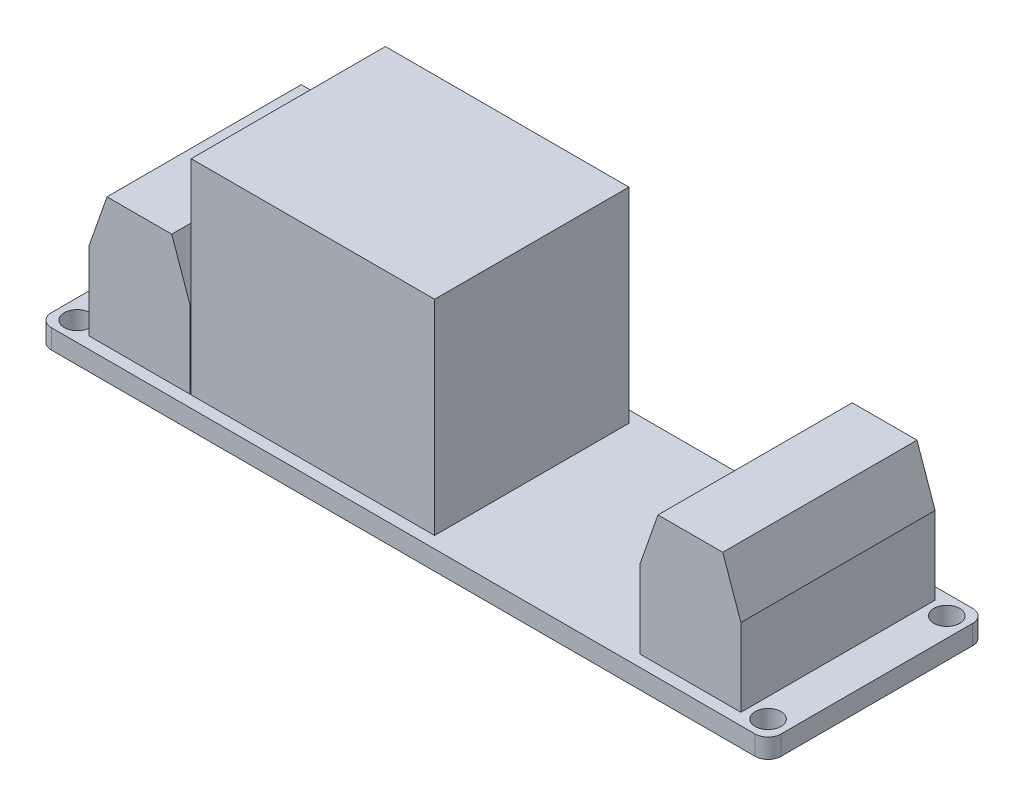
from build123d import *

# Parameters (mm, degrees)
SKETCH1_W               = 56.35
SKETCH1_H               = 16.8
BOSS_EXTRUDE1_DEPTH     = 1.5
SKETCH2_R               = 1
CUT_EXTRUDE1_DEPTH      = 30.438760589
MIRROR2_COPY_1_SKETCH_R = 1
MIRROR2_COPY_1_DEPTH    = 30.438760589
FILLET1_R               = 1
BOSS_EXTRUDE2_DEPTH     = 7.5
SKETCH4_W               = 18.8
SKETCH4_H               = 15.8
BOSS_EXTRUDE3_DEPTH     = 7.5


with BuildPart() as part:
    # Sketch1 → Boss-Extrude1 (new body)
    with BuildSketch(Plane(origin=(0, 0, 0), x_dir=(1, 0, 0), z_dir=(0, 1, 0))):
        Rectangle(SKETCH1_W, SKETCH1_H)
    extrude(amount=BOSS_EXTRUDE1_DEPTH)

    # Sketch2 → Cut-Extrude1 (cut, through all)
    with BuildSketch(Plane(origin=(0, 1.5, 0), x_dir=(1, 0, 0), z_dir=(0, 1, 0))):
        with Locations(Location((-26.675, 6.9, 0), (0, 0, 270))):
            Circle(SKETCH2_R)
    cut_extrude1 = extrude(amount=-CUT_EXTRUDE1_DEPTH, mode=Mode.SUBTRACT)

    # Mirror1: Cut-Extrude1 across plane
    add(cut_extrude1.mirror(Plane.XY), mode=Mode.SUBTRACT)

    # Mirror2: Cut-Extrude1 across plane
    add(cut_extrude1.mirror(Plane(origin=(0, 0, 0), x_dir=(0, 0, 1), z_dir=(1, 0, 0))), mode=Mode.SUBTRACT)

    # Mirror2 copy 1 sketch → Mirror2 copy 1 (cut, through all)
    with BuildSketch(Plane(origin=(0, 1.5, 0), x_dir=(-1, 0, 0), z_dir=(0, 1, 0))):
        with Locations(Location((-26.675, 6.9, 0), (0, 0, 270))):
            Circle(MIRROR2_COPY_1_SKETCH_R)
    extrude(amount=-MIRROR2_COPY_1_DEPTH, mode=Mode.SUBTRACT)

    # Fillet1
    fillet1_edges = [part.edges().sort_by_distance(p)[0] for p in [
        (28.175, 0.75, 8.4),
        (-28.175, 0.75, 8.4),
        (-28.175, 0.75, -8.4),
        (28.175, 0.75, -8.4),
    ]]
    fillet(fillet1_edges, radius=FILLET1_R)

    # Sketch3 → Boss-Extrude2 (add, symmetric)
    with BuildSketch(Plane.XY):
        Polygon((18.775, 11.5), (17.375, 7.5), (17.375, 1.5), (25.175, 1.5), (25.175, 7.5), (23.775, 11.5), align=None)
    boss_extrude2 = extrude(amount=BOSS_EXTRUDE2_DEPTH, both=True)

    # Mirror3: Boss-Extrude2 across plane
    add(boss_extrude2.mirror(Plane(origin=(0, 0, 0), x_dir=(0, 0, 1), z_dir=(1, 0, 0))))

    # Sketch4 → Boss-Extrude3 (add, symmetric)
    with BuildSketch(Plane.XY):
        with Locations((-7.875, 9.4)):
            Rectangle(SKETCH4_W, SKETCH4_H)
    extrude(amount=BOSS_EXTRUDE3_DEPTH, both=True)


solid = part.part
